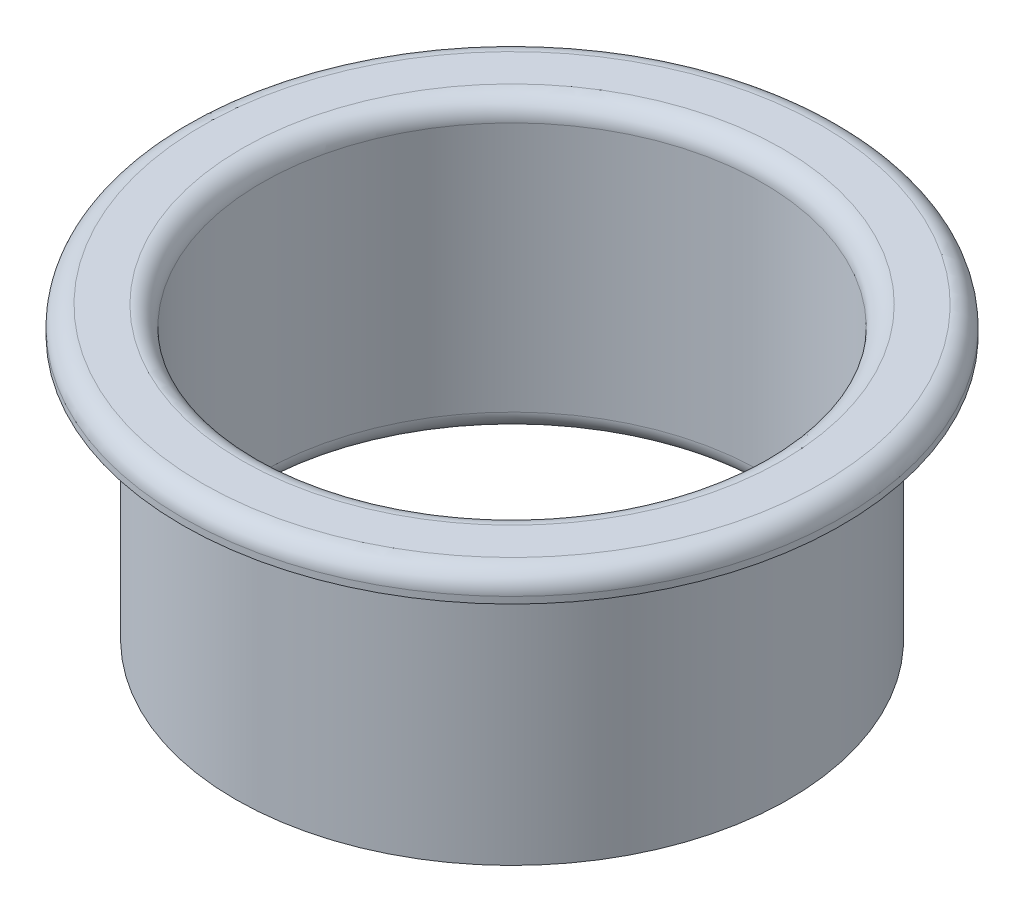
from build123d import *

# Parameters (mm, degrees)
SKETCH1_R           = 10.5
SKETCH1_R_2         = 9.5
BOSS_EXTRUDE1_DEPTH = 10
BOSS_EXTRUDE2_START = 1
SKETCH2_R           = 12.5
SKETCH2_R_2         = 9.5
BOSS_EXTRUDE2_DEPTH = 1
FILLET1_R           = 0.75


with BuildPart() as part:
    # Sketch1 → Boss-Extrude1 (new body)
    with BuildSketch(Plane(origin=(0, 0, 0), x_dir=(1, 0, 0), z_dir=(0, 1, 0))):
        with Locations(Location((0, 0, 0), (0, 0, 270))):
            Circle(SKETCH1_R)
        with Locations(Location((0, 0, 0), (0, 0, 270))):
            Circle(SKETCH1_R_2, mode=Mode.SUBTRACT)
    extrude(amount=-BOSS_EXTRUDE1_DEPTH)

    # Sketch2 → Boss-Extrude2 (add)
    with BuildSketch(Plane(origin=(0, 0, 0), x_dir=(1, 0, 0), z_dir=(0, 1, 0)).offset(BOSS_EXTRUDE2_START)):
        with Locations(Location((0, 0, 0), (0, 0, 270))):
            Circle(SKETCH2_R)
        with Locations(Location((0, 0, 0), (0, 0, 270))):
            Circle(SKETCH2_R_2, mode=Mode.SUBTRACT)
    extrude(amount=-BOSS_EXTRUDE2_DEPTH)

    # Fillet1
    fillet1_edges = [part.edges().sort_by_distance(p)[0] for p in [
        (0, 1, -12.5),
        (0, 1, -9.5),
        (0, 0, -10.5),
        (0, -10, -9.5),
    ]]
    fillet(fillet1_edges, radius=FILLET1_R)


solid = part.part
